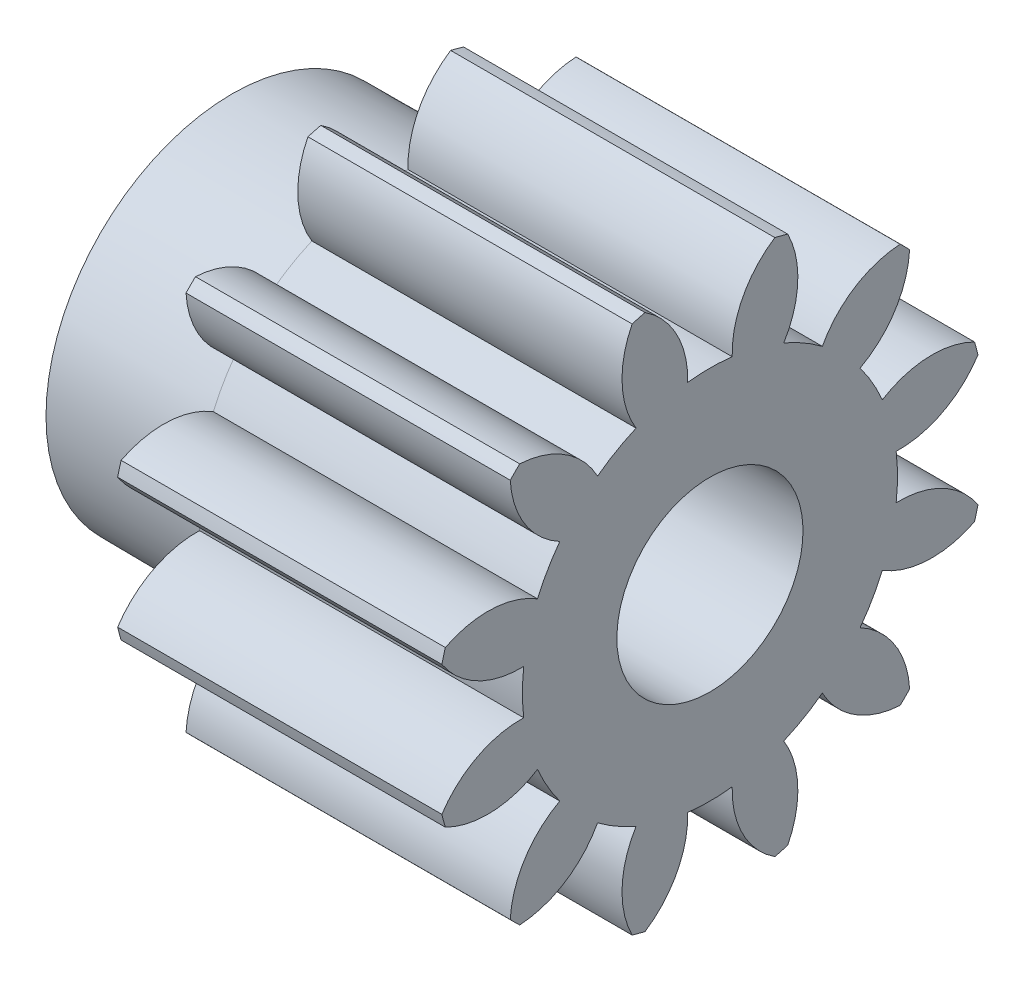
from build123d import *

# Parameters (mm, degrees)
BASPROSKE_W             = 12.7
BASPROSKE_H             = 8.89
TOOTHCUT_DEPTH          = 18.870484045
TEETHCUTS_COUNT         = 12
TEETHCUTS_ANGLE         = 330
BORSKE_R                = 3
BORE_DEPTH              = 50.8000508
CUT_EXTRUDE1_DEPTH      = 18.6238176
CUT_EXTRUDE1_DEPTH_BACK = 18.6238176
SKETCH2_W               = 2.25
SKETCH2_H               = 17.280564042


with BuildPart() as part:
    # BasProSke → Base-Revolve (revolve)
    with BuildSketch(Plane(origin=(0, 0, 0), x_dir=(1, 0, 0), z_dir=(0, 1, 0)), mode=Mode.PRIVATE) as base_revolve_sk:
        with Locations((6.35, 4.445)):
            Rectangle(BASPROSKE_W, BASPROSKE_H)
    revolve(base_revolve_sk.sketch.rotate(Axis((-10, 0, 0), (1, 0, 0)), 180), axis=Axis((-10, 0, 0), (1, 0, 0)))

    # TooCutSke → ToothCut (cut, through all)
    with BuildSketch(Plane(origin=(0, 0, 0), x_dir=(0, 0, -1), z_dir=(1, 0, 0))):
        with BuildLine():
            ThreePointArc((0.717076553, 6.002519826), (0, 6.0452), (-0.717076553, 6.002519826))
            ThreePointArc((-0.717076553, 6.002519826), (-1.069160545, 7.516029346), (-2.121611652, 8.659279483))
            ThreePointArc((-2.121611652, 8.659279483), (0, 8.9154), (2.121611652, 8.659279483))
            ThreePointArc((2.121611652, 8.659279483), (1.069160545, 7.516029346), (0.717076553, 6.002519826))
        make_face()
    toothcut = extrude(amount=TOOTHCUT_DEPTH, mode=Mode.SUBTRACT)

    # TeethCuts: ToothCut ×12 about axis
    teethcuts_axis = Axis((-10, 0, 0), (1, 0, 0))
    for i in range(1, TEETHCUTS_COUNT):
        add(toothcut.rotate(teethcuts_axis, i * TEETHCUTS_ANGLE / (TEETHCUTS_COUNT - 1)), mode=Mode.SUBTRACT)

    # BorSke → Bore (cut, symmetric)
    with BuildSketch(Plane(origin=(0, 0, 0), x_dir=(0, 0, -1), z_dir=(1, 0, 0))):
        with Locations(Location((0, 0, 0), (0, 0, 180))):
            Circle(BORSKE_R)
    extrude(amount=BORE_DEPTH, both=True, mode=Mode.SUBTRACT)

    # Sketch1 → Revolve1 (revolve)
    with BuildSketch(Plane.XY, mode=Mode.PRIVATE) as revolve1_sk:
        Polygon((0, -4), (-4.95, -4), (-4.95, -6), (0, -6.0452), align=None)
    revolve(revolve1_sk.sketch.rotate(Axis((0, 0, 0), (-1, 0, 0)), 270), axis=Axis((0, 0, 0), (-1, 0, 0)))

    # Sketch2 → Cut-Extrude1 (cut, two sides: drawn at the far end of the back side and taken through both)
    with BuildSketch(Plane.XY.offset(-CUT_EXTRUDE1_DEPTH_BACK)):
        with Locations((11.575, 0)):
            Rectangle(SKETCH2_W, SKETCH2_H)
    extrude(amount=CUT_EXTRUDE1_DEPTH + CUT_EXTRUDE1_DEPTH_BACK, mode=Mode.SUBTRACT)


solid = part.part
